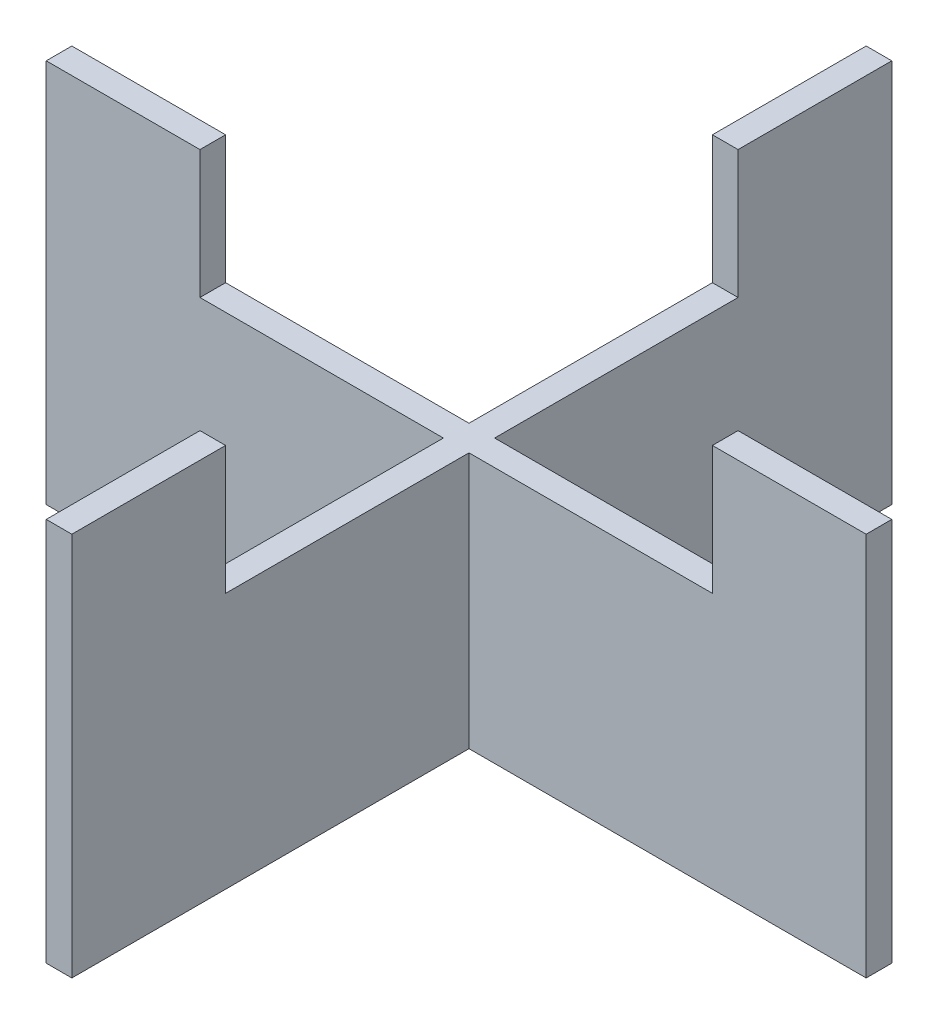
from build123d import *

# Parameters (mm, degrees)
SALIENTE_EXTRUIR1_DEPTH = 15
CROQUIS2_W              = 20
CROQUIS2_H              = 20
CORTAR_EXTRUIR1_DEPTH   = 5


with BuildPart() as part:
    # Croquis1 → Saliente-Extruir1 (new body)
    with BuildSketch(Plane(origin=(0, 0, 0), x_dir=(1, 0, 0), z_dir=(0, 1, 0))):
        Polygon((0, 0), (15.5, 0), (15.5, -15.5), (16.5, -15.5), (16.5, 0), (32, 0), (32, 1), (16.5, 1), (16.5, 16.5), (15.5, 16.5), (15.5, 1), (0, 1), align=None)
    extrude(amount=SALIENTE_EXTRUIR1_DEPTH)

    # Croquis2 → Cortar-Extruir1 (cut)
    with BuildSketch(Plane(origin=(0, 15, 0), x_dir=(1, 0, 0), z_dir=(0, 1, 0))):
        with Locations((16, 0.5)):
            Rectangle(CROQUIS2_W, CROQUIS2_H)
    extrude(amount=-CORTAR_EXTRUIR1_DEPTH, mode=Mode.SUBTRACT)


solid = part.part
